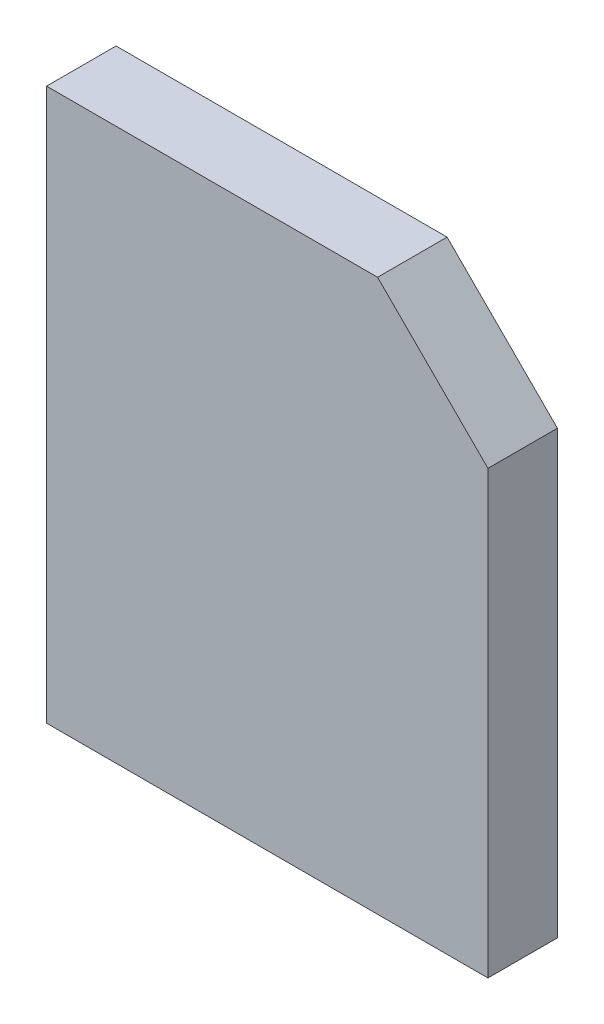
from build123d import *

# Parameters (mm, degrees)
BOSS_EXTRUDE1_DEPTH = 1.6


with BuildPart() as part:
    # Sketch2 → Boss-Extrude1 (new body)
    with BuildSketch(Plane.XY.offset(2.3)):
        Polygon((-5.08, -6.35), (5.08, -6.35), (5.08, 3.81), (2.54, 6.35), (-5.08, 6.35), align=None)
    extrude(amount=BOSS_EXTRUDE1_DEPTH)


solid = part.part
